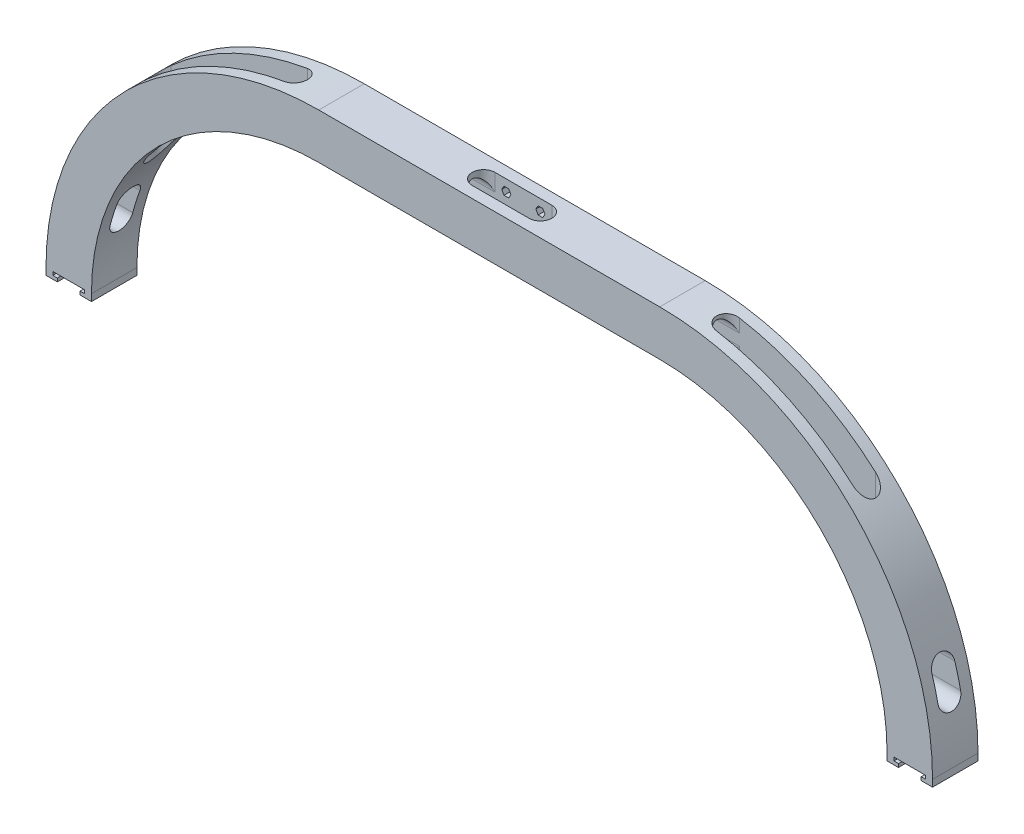
from build123d import *

# Parameters (mm, degrees)
AUFSATZ_LINEAR_AUSTRAGEN1_DEPTH      = 150
SCHNITT_LINEAR_AUSTRAGEN2_DEPTH      = 658.647321898
SCHNITT_LINEAR_AUSTRAGEN2_DEPTH_BACK = 658.647321898
SCHNITT_LINEAR_AUSTRAGEN7_REACH      = 928.607
SCHNITT_LINEAR_AUSTRAGEN7_END_RADIUS = 10
SCHNITT_LINEAR_AUSTRAGEN8_DEPTH      = 180
AUFSATZ_LINEAR_AUSTRAGEN2_DEPTH      = 150
SKIZZE15_W                           = 1390.722154613
SKIZZE15_H                           = 110
SCHNITT_LINEAR_AUSTRAGEN16_DEPTH     = 1000
SCHNITT_LINEAR_AUSTRAGEN22_DEPTH     = 200
SCHNITT_LINEAR_AUSTRAGEN27_DEPTH     = 120
SKIZZE2_R                            = 5
SCHNITT_LINEAR_AUSTRAGEN28_DEPTH     = 10
AUFSATZ_LINEAR_AUSTRAGEN3_DEPTH      = 40
SCHNITT_LINEAR_AUSTRAGEN29_DEPTH     = 200
SCHNITT_LINEAR_START                 = 300
SCHNITT_LINEAR_AUSTRAGEN30_DEPTH     = 300


with BuildPart() as part:
    # Skizze1 → Aufsatz-Linear austragen1 (new body)
    with BuildSketch(Plane.XY):
        with BuildLine():
            Line((150, 600), (-150, 600))
            ThreePointArc((-150, 600), (-353.150600634, 544.571956871), (-500, 393.64916731))
            Line((-500, 393.64916731), (-500, 200))
            Line((-500, 200), (-350, 200))
            ThreePointArc((-350, 200), (-291.421356237, 341.421356237), (-150, 400))
            Line((-150, 400), (150, 400))
            ThreePointArc((150, 400), (291.421356237, 341.421356237), (350, 200))
            Line((350, 200), (500, 200))
            Line((500, 200), (500, 393.64916731))
            ThreePointArc((500, 393.64916731), (353.150600634, 544.571956871), (150, 600))
        make_face()
    extrude(amount=AUFSATZ_LINEAR_AUSTRAGEN1_DEPTH)

    # Skizze4 → Schnitt-Linear austragen2 (cut, two sides: drawn at the far end of the back side and taken through both)
    with BuildSketch(Plane(origin=(0, 600, 0), x_dir=(1, 0, 0), z_dir=(0, 1, 0)).offset(-SCHNITT_LINEAR_AUSTRAGEN2_DEPTH_BACK)):
        with BuildLine():
            Line((-310, -120), (-190, -120))
            ThreePointArc((-190, -120), (-180, -130), (-190, -140))
            Line((-190, -140), (-310, -140))
            ThreePointArc((-310, -140), (-320, -130), (-310, -120))
        make_face()
        with BuildLine():
            Line((190, -120), (310, -120))
            ThreePointArc((310, -120), (320, -130), (310, -140))
            Line((310, -140), (190, -140))
            ThreePointArc((190, -140), (180, -130), (190, -120))
        make_face()
    extrude(amount=SCHNITT_LINEAR_AUSTRAGEN2_DEPTH + SCHNITT_LINEAR_AUSTRAGEN2_DEPTH_BACK, mode=Mode.SUBTRACT)

    # Schnitt-Linear austragen7: up to this cylinder (the profile starts outside it)
    schnitt_linear_austragen7_end = Plane(origin=(190, 420, 130), z_dir=(0, 1, 0)) * Cylinder(SCHNITT_LINEAR_AUSTRAGEN7_END_RADIUS, 1878.214, mode=Mode.PRIVATE)
    # Skizze5 → Schnitt-Linear austragen7 (cut, up to the surface)
    with BuildSketch(Plane.ZY.offset(190), mode=Mode.PRIVATE) as schnitt_linear_austragen7_sk1:
        with BuildLine():
            Line((140, 425), (140, 415))
            ThreePointArc((140, 415), (130, 405), (120, 415))
            Line((120, 415), (120, 425))
            ThreePointArc((120, 425), (130, 435), (140, 425))
        make_face()
    schnitt_linear_austragen7_tool1 = extrude(schnitt_linear_austragen7_sk1.sketch, amount=-SCHNITT_LINEAR_AUSTRAGEN7_REACH, mode=Mode.PRIVATE) - schnitt_linear_austragen7_end
    add(schnitt_linear_austragen7_tool1.solids().sort_by_distance((-190, 420, 130))[0], mode=Mode.SUBTRACT)

    # Skizze3 → Schnitt-Linear austragen8 (cut)
    with BuildSketch(Plane(origin=(0, 600, 0), x_dir=(1, 0, 0), z_dir=(0, 1, 0))):
        with BuildLine():
            Line((-25, -120), (25, -120))
            ThreePointArc((25, -120), (35, -130), (25, -140))
            Line((25, -140), (-25, -140))
            ThreePointArc((-25, -140), (-35, -130), (-25, -120))
        make_face()
    extrude(amount=-SCHNITT_LINEAR_AUSTRAGEN8_DEPTH, mode=Mode.SUBTRACT)

    # Skizze11 → Aufsatz-Linear austragen2 (add)
    with BuildSketch(Plane.XY):
        Polygon((356, 200), (350, 200), (350, 194), (360, 194), (360, 197), (356, 197), align=None)
        Polygon((390, 194), (390, 200), (384, 200), (384, 197), (380, 197), (380, 194), align=None)
    extrude(amount=AUFSATZ_LINEAR_AUSTRAGEN2_DEPTH)

    # Skizze15 → Schnitt-Linear austragen16 (cut)
    with BuildSketch(Plane(origin=(0, 600, 0), x_dir=(1, 0, 0), z_dir=(0, 1, 0))):
        with Locations((37.447933541, -55)):
            Rectangle(SKIZZE15_W, SKIZZE15_H)
    extrude(amount=-SCHNITT_LINEAR_AUSTRAGEN16_DEPTH, mode=Mode.SUBTRACT)

    # Skizze17 → Schnitt-Linear austragen22 (cut)
    with BuildSketch(Plane.XY.offset(150)):
        with BuildLine():
            ThreePointArc((-728.904569039, 200), (-39.53876737, 889.365801669), (649.827034299, 200))
            Line((649.827034299, 200), (390, 200))
            ThreePointArc((390, 200), (319.705627485, 369.705627485), (150, 440))
            Line((150, 440), (-150, 440))
            ThreePointArc((-150, 440), (-319.705627485, 369.705627485), (-390, 200))
            Line((-390, 200), (-728.904569039, 200))
        make_face()
    extrude(amount=-SCHNITT_LINEAR_AUSTRAGEN22_DEPTH, mode=Mode.SUBTRACT)

    # Skizze9 → Schnitt-Linear austragen27 (cut)
    with BuildSketch(Plane(origin=(0, 0, 0), x_dir=(-1, 0, 0), z_dir=(0, 0, -1))):
        Polygon((-12.979274058, 426.5), (-10.958548116, 430), (-12.979274058, 433.5), (-17.020725942, 433.5), (-19.041451884, 430), (-17.020725942, 426.5), align=None)
        Polygon((17.020725942, 426.5), (12.979274058, 426.5), (10.958548116, 430), (12.979274058, 433.5), (17.020725942, 433.5), (19.041451884, 430), align=None)
        Polygon((-12.979274058, 406.5), (-10.958548116, 410), (-12.979274058, 413.5), (-17.020725942, 413.5), (-19.041451884, 410), (-17.020725942, 406.5), align=None)
        Polygon((17.020725942, 406.5), (12.979274058, 406.5), (10.958548116, 410), (12.979274058, 413.5), (17.020725942, 413.5), (19.041451884, 410), align=None)
    extrude(amount=-SCHNITT_LINEAR_AUSTRAGEN27_DEPTH, mode=Mode.SUBTRACT)

    # Skizze2 → Schnitt-Linear austragen28 (cut)
    with BuildSketch(Plane.XZ.offset(-200)):
        with Locations(Location((-370, 130, 0), (0, 0, 270))):
            Circle(SKIZZE2_R)
        with Locations(Location((370, 130, 0), (0, 0, 270))):
            Circle(SKIZZE2_R)
    extrude(amount=-SCHNITT_LINEAR_AUSTRAGEN28_DEPTH, mode=Mode.SUBTRACT)

    # Skizze21 → Aufsatz-Linear austragen3 (add)
    with BuildSketch(Plane.XY.offset(150)):
        Polygon((-384, 200), (-390, 200), (-390, 194), (-380, 194), (-380, 197), (-384, 197), align=None)
        Polygon((-350, 194), (-350, 200), (-356, 200), (-356, 197), (-360, 197), (-360, 194), align=None)
    extrude(amount=-AUFSATZ_LINEAR_AUSTRAGEN3_DEPTH)

    # Skizze22 → Schnitt-Linear austragen29 (cut)
    with BuildSketch(Plane.ZY.offset(190)):
        with BuildLine():
            Line((140, 270), (140, 250))
            ThreePointArc((140, 250), (130, 240), (120, 250))
            Line((120, 250), (120, 270))
            ThreePointArc((120, 270), (130, 280), (140, 270))
        make_face()
    extrude(amount=SCHNITT_LINEAR_AUSTRAGEN29_DEPTH, mode=Mode.SUBTRACT)

    # Skizze23 → Schnitt-Linear austragen30 (cut)
    with BuildSketch(Plane(origin=(150, 0, 0), x_dir=(0, 0, -1), z_dir=(1, 0, 0)).offset(SCHNITT_LINEAR_START)):
        with BuildLine():
            Line((-120, 270), (-120, 250))
            ThreePointArc((-120, 250), (-130, 240), (-140, 250))
            Line((-140, 250), (-140, 270))
            ThreePointArc((-140, 270), (-130, 280), (-120, 270))
        make_face()
    extrude(amount=-SCHNITT_LINEAR_AUSTRAGEN30_DEPTH, mode=Mode.SUBTRACT)


solid = part.part
